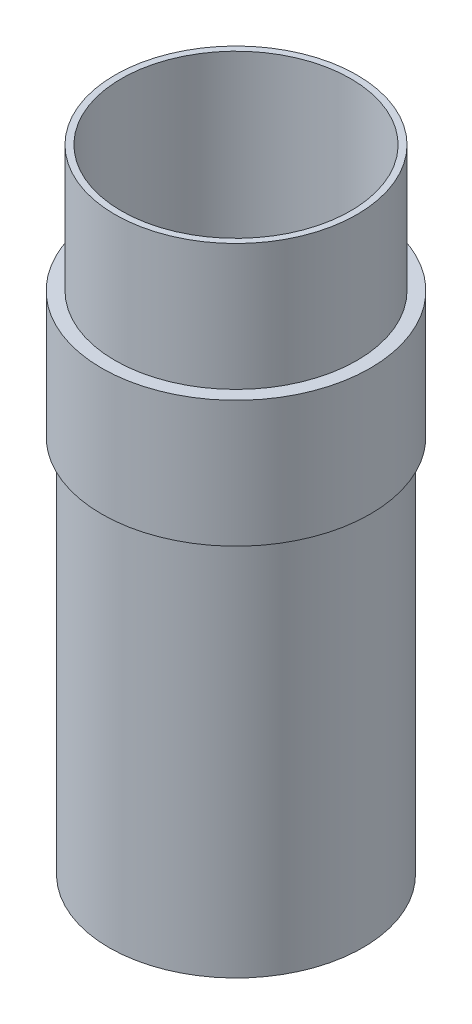
from build123d import *

# Parameters (mm, degrees)
SKETCH1_W   = 1.27
SKETCH1_H   = 25.4
SKETCH1_W_2 = 1.4732
SKETCH1_W_3 = 2.473987507
SKETCH1_H_2 = 76.2


with BuildPart() as part:
    # Sketch1 → Revolve1 (revolve)
    with BuildSketch(Plane.XY, mode=Mode.PRIVATE) as revolve1_sk:
        with Locations((23.675312493, 66.261527288)):
            Rectangle(SKETCH1_W, SKETCH1_H)
        Polygon((24.310312493, 53.561527288), (23.040312493, 53.561527288), (23.040312493, 28.161527288), (25.5143, 28.161527288), (25.5143, 53.561527288), align=None)
        with Locations((26.2509, 40.861527288)):
            Rectangle(SKETCH1_W_2, SKETCH1_H)
        with Locations((24.277306247, -9.938472712)):
            Rectangle(SKETCH1_W_3, SKETCH1_H_2)
    revolve(revolve1_sk.sketch.rotate(Axis((0, 0, 0), (0, 1, 0)), 90), axis=Axis((0, 0, 0), (0, 1, 0)))


solid = part.part
